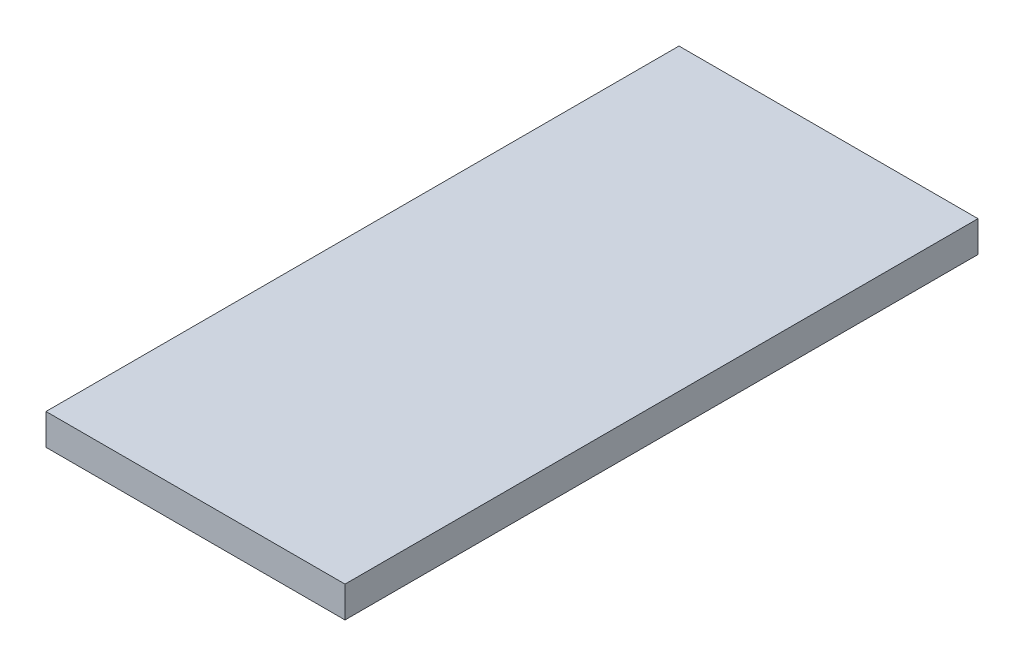
from build123d import *

# Parameters (mm, degrees)
SKETCH_1_W      = 77
SKETCH_1_H      = 163
EXTRUDE_1_DEPTH = 8


with BuildPart() as part:
    # 草图1 → 凸台-拉伸1 (new body)
    with BuildSketch(Plane(origin=(0, 0, 0), x_dir=(1, 0, 0), z_dir=(0, 1, 0))):
        with Locations((38.5, -81.5)):
            Rectangle(SKETCH_1_W, SKETCH_1_H)
    extrude(amount=EXTRUDE_1_DEPTH)


solid = part.part
